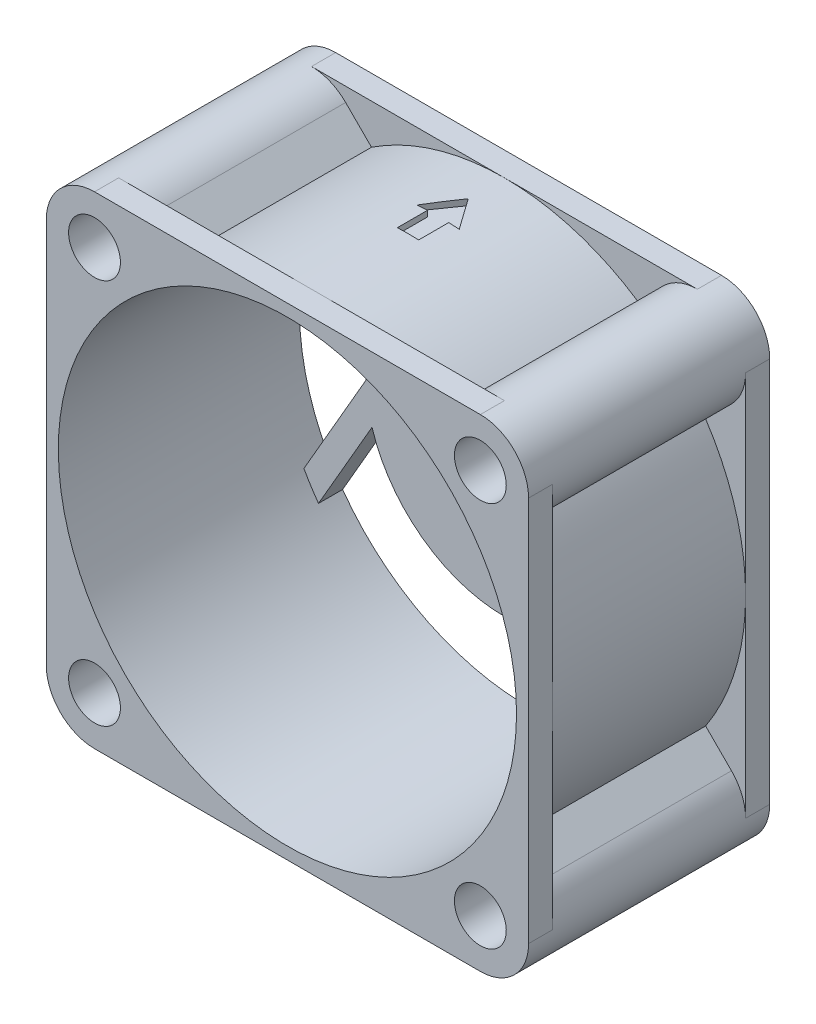
from build123d import *

# Parameters (mm, degrees)
SKETCH_BODY_R                       = 19
BODY_DEPTH                          = 20
SKETCH_CUT_BODY_W                   = 16
SKETCH_CUT_BODY_H                   = 6.627416998
REINFORCMENT_STRIP_REACH            = 36.641
CIRPATTERN_REINFORCMENT_STRIP_COUNT = 4
SKETCH_FIXING_HOLE_R                = 2.15
FIXING_HOLE_DEPTH                   = 35.641016151
CIRPATTERN_FIXING_HOLE_COUNT        = 4
BONE_DEPTH                          = 2
CIRPATTERN_BONE_COUNT               = 3
SKETCH_FIXING_PLATE_FAN_R           = 11.5
FIXING_PLATE_FAN_DEPTH              = 2
AIR_EXHAUST_DEPTH                   = 49.582404222


with BuildPart() as part:
    # Sketch-Body → Body (new body)
    with BuildSketch(Plane.XY):
        with BuildLine():
            Line((-16, -20), (16, -20))
            ThreePointArc((16, -20), (18.828427125, -18.828427125), (20, -16))
            Line((20, -16), (20, 16))
            ThreePointArc((20, 16), (18.828427125, 18.828427125), (16, 20))
            Line((16, 20), (-16, 20))
            ThreePointArc((-16, 20), (-18.828427125, 18.828427125), (-20, 16))
            Line((-20, 16), (-20, -16))
            ThreePointArc((-20, -16), (-18.828427125, -18.828427125), (-16, -20))
        make_face()
        Circle(SKETCH_BODY_R, mode=Mode.SUBTRACT)
    extrude(amount=BODY_DEPTH)

    # Sketch-Cut-Body → Cut-Body (revolve, cut)
    with BuildSketch(Plane(origin=(0, 0, 0), x_dir=(0, 0, -1), z_dir=(1, 0, 0)), mode=Mode.PRIVATE) as cut_body_sk:
        with Locations((-10, 23.313708499)):
            Rectangle(SKETCH_CUT_BODY_W, SKETCH_CUT_BODY_H)
    revolve(cut_body_sk.sketch.rotate(Axis((0, 0, 20), (0, 0, -1)), 180), axis=Axis((0, 0, 20), (0, 0, -1)), mode=Mode.SUBTRACT)

    # Sketch-Reinforcment-Strip → Reinforcment-Strip (add, up to next)
    with BuildSketch(Plane.XY, mode=Mode.PRIVATE) as reinforcment_strip_sk1:
        with BuildLine():
            Line((16.684833585, 11.027979336), (18.828427125, 13.171572875))
            ThreePointArc((18.828427125, 13.171572875), (18.828427125, 18.828427125), (13.171572875, 18.828427125))
            Line((13.171572875, 18.828427125), (11.027979336, 16.684833585))
            ThreePointArc((11.027979336, 16.684833585), (14.142135624, 14.142135624), (16.684833585, 11.027979336))
        make_face()
    reinforcment_strip_tool1 = extrude(reinforcment_strip_sk1.sketch, amount=REINFORCMENT_STRIP_REACH, mode=Mode.PRIVATE) - part.part
    reinforcment_strip = reinforcment_strip_tool1.solids().sort_by_distance((16.181232, 16.181232, 0))[0]
    add(reinforcment_strip)

    # CirPattern-Reinforcment-Strip: Reinforcment-Strip ×4 about axis
    cirpattern_reinforcment_strip_axis = Axis((0, 0, 0), (0, 0, 1))
    for i in range(1, CIRPATTERN_REINFORCMENT_STRIP_COUNT):
        add(reinforcment_strip.rotate(cirpattern_reinforcment_strip_axis, i * 360 / CIRPATTERN_REINFORCMENT_STRIP_COUNT))

    # Sketch-Fixing-Hole → Fixing-Hole (cut, through all)
    with BuildSketch(Plane.XY):
        with Locations((16, 16)):
            Circle(SKETCH_FIXING_HOLE_R)
    fixing_hole = extrude(amount=FIXING_HOLE_DEPTH, mode=Mode.SUBTRACT)

    # CirPattern-Fixing-Hole: Fixing-Hole ×4 about axis
    cirpattern_fixing_hole_axis = Axis((0, 0, 0), (0, 0, 1))
    for i in range(1, CIRPATTERN_FIXING_HOLE_COUNT):
        add(fixing_hole.rotate(cirpattern_fixing_hole_axis, i * 360 / CIRPATTERN_FIXING_HOLE_COUNT), mode=Mode.SUBTRACT)

    # Sketch-Bone → Bone (add)
    with BuildSketch(Plane.XY):
        with BuildLine():
            Line((-10.98406242, -3.405931994), (-15.423655551, -11.09553286))
            ThreePointArc((-15.423655551, -11.09553286), (-16.055816657, -10.159269239), (-16.631216794, -9.187090287))
            Line((-16.631216794, -9.187090287), (-11.496264484, -0.293091992))
            ThreePointArc((-11.496264484, -0.293091992), (-11.347410174, -1.867158898), (-10.98406242, -3.405931994))
        make_face()
    bone = extrude(amount=BONE_DEPTH)

    # CirPattern-Bone: Bone ×3 about axis
    cirpattern_bone_axis = Axis((0, 0, 0), (0, 0, 1))
    for i in range(1, CIRPATTERN_BONE_COUNT):
        add(bone.rotate(cirpattern_bone_axis, i * 360 / CIRPATTERN_BONE_COUNT))

    # Sketch-Fixing-Plate-Fan → Fixing-Plate-Fan (add)
    with BuildSketch(Plane.XY):
        Circle(SKETCH_FIXING_PLATE_FAN_R)
    extrude(amount=FIXING_PLATE_FAN_DEPTH)

    # Sketch2 → Air-Exhaust (cut, through all)
    with BuildSketch(Plane(origin=(0, 19.5, 0), x_dir=(-1, 0, 0), z_dir=(0, 1, 0))):
        Polygon((-1.750518846, 7.5), (0, 5), (1.750518846, 7.5), (0.881634904, 7.5), (0.881634904, 10), (-0.881634904, 10), (-0.881634904, 7.5), align=None)
    extrude(amount=AIR_EXHAUST_DEPTH, mode=Mode.SUBTRACT)


solid = part.part
